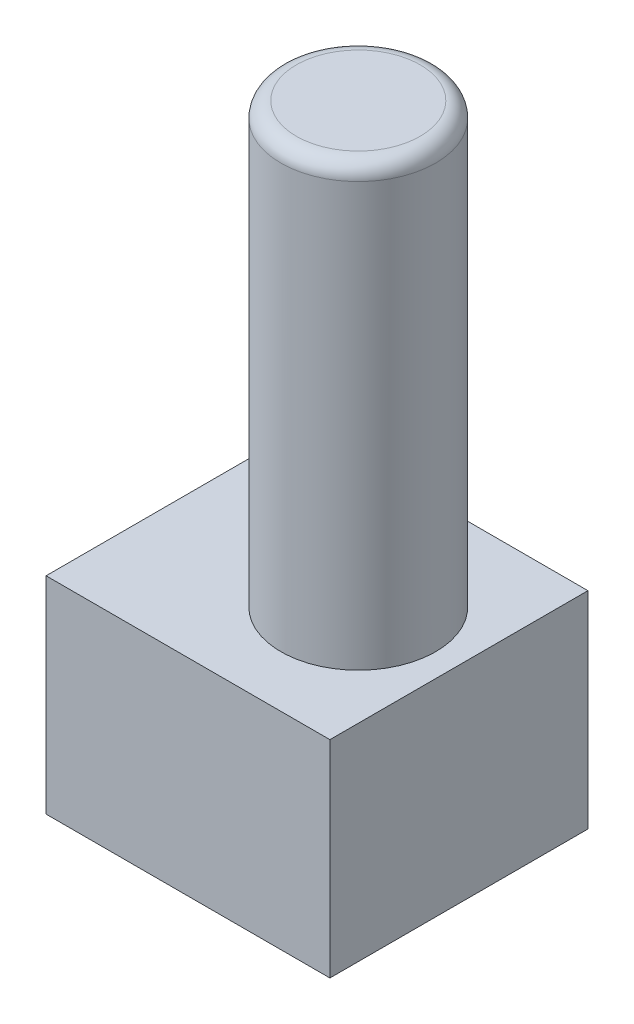
from build123d import *

# Parameters (mm, degrees)
SKETCH1_R           = 3
BOSS_EXTRUDE1_DEPTH = 25
SKETCH1_3_W         = 11
SKETCH1_3_H         = 10
SKETCH1_3_R         = 3
BOSS_EXTRUDE2_DEPTH = 8
FILLET1_R           = 0.6


with BuildPart() as part:
    # Sketch1 → Boss-Extrude1 (new body)
    with BuildSketch(Plane(origin=(0, 0, 0), x_dir=(1, 0, 0), z_dir=(0, 1, 0))):
        with Locations((1.6, 0)):
            Circle(SKETCH1_R)
    extrude(amount=BOSS_EXTRUDE1_DEPTH)

    # Sketch1<3> → Boss-Extrude2 (add)
    with BuildSketch(Plane(origin=(0, 0, 0), x_dir=(1, 0, 0), z_dir=(0, 1, 0))):
        Rectangle(SKETCH1_3_W, SKETCH1_3_H)
        with Locations((1.6, 0)):
            Circle(SKETCH1_3_R, mode=Mode.SUBTRACT)
    extrude(amount=BOSS_EXTRUDE2_DEPTH)

    # Fillet1
    fillet1_edges = [part.edges().sort_by_distance(p)[0] for p in [
        (-1.4, 25, 0),
    ]]
    fillet(fillet1_edges, radius=FILLET1_R)


solid = part.part
